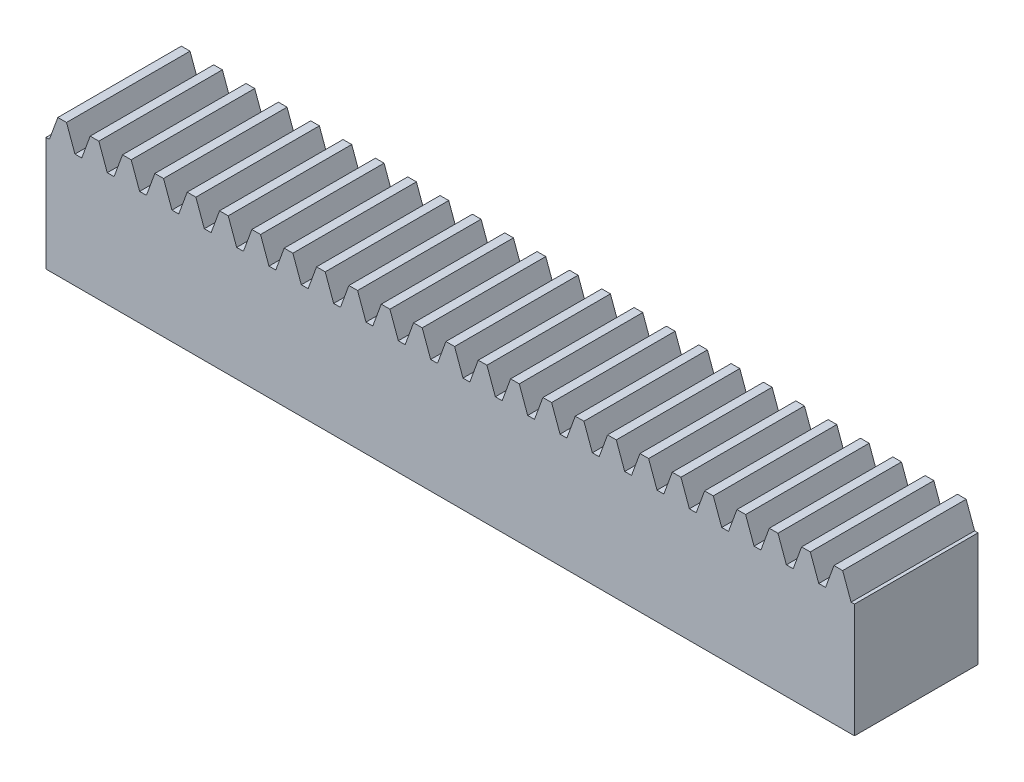
from build123d import *

# Parameters (mm, degrees)
BOSS_EXTRU_1_DEPTH = 9


with BuildPart() as part:
    # Esquisse1 → Boss.-Extru.1 (new body)
    with BuildSketch(Plane(origin=(0, 0, 0), x_dir=(-1, 0, 0), z_dir=(0, 0, -1))):
        Polygon((-58.904862255, 8.3125), (-58.904862255, 0), (0, 0), (0, 8.3125), (-0.247826528, 8.3125), (-0.862026298, 10), (-1.494168192, 10), (-2.108367962, 8.3125), (-2.604021018, 8.3125), (-3.218220788, 10), (-3.850362682, 10), (-4.464562452, 8.3125), (-4.960215508, 8.3125), (-5.574415279, 10), (-6.206557172, 10), (-6.820756943, 8.3125), (-7.316409999, 8.3125), (-7.930609769, 10), (-8.562751663, 10), (-9.176951433, 8.3125), (-9.672604489, 8.3125), (-10.286804259, 10), (-10.918946153, 10), (-11.533145923, 8.3125), (-12.028798979, 8.3125), (-12.642998749, 10), (-13.275140643, 10), (-13.889340413, 8.3125), (-14.384993469, 8.3125), (-14.999193239, 10), (-15.631335133, 10), (-16.245534903, 8.3125), (-16.741187959, 8.3125), (-17.35538773, 10), (-17.987529623, 10), (-18.601729394, 8.3125), (-19.097382449, 8.3125), (-19.71158222, 10), (-20.343724113, 10), (-20.957923884, 8.3125), (-21.45357694, 8.3125), (-22.06777671, 10), (-22.699918604, 10), (-23.314118374, 8.3125), (-23.80977143, 8.3125), (-24.4239712, 10), (-25.056113094, 10), (-25.670312864, 8.3125), (-26.16596592, 8.3125), (-26.78016569, 10), (-27.412307584, 10), (-28.026507354, 8.3125), (-28.52216041, 8.3125), (-29.136360181, 10), (-29.768502074, 10), (-30.382701845, 8.3125), (-30.8783549, 8.3125), (-31.492554671, 10), (-32.124696564, 10), (-32.738896335, 8.3125), (-33.234549391, 8.3125), (-33.848749161, 10), (-34.480891055, 10), (-35.095090825, 8.3125), (-35.590743881, 8.3125), (-36.204943651, 10), (-36.837085545, 10), (-37.451285315, 8.3125), (-37.946938371, 8.3125), (-38.561138141, 10), (-39.193280035, 10), (-39.807479805, 8.3125), (-40.303132861, 8.3125), (-40.917332632, 10), (-41.549474525, 10), (-42.163674296, 8.3125), (-42.659327351, 8.3125), (-43.273527122, 10), (-43.905669015, 10), (-44.519868786, 8.3125), (-45.015521842, 8.3125), (-45.629721612, 10), (-46.261863506, 10), (-46.876063276, 8.3125), (-47.371716332, 8.3125), (-47.985916102, 10), (-48.618057996, 10), (-49.232257766, 8.3125), (-49.727910822, 8.3125), (-50.342110592, 10), (-50.974252486, 10), (-51.588452256, 8.3125), (-52.084105312, 8.3125), (-52.698305082, 10), (-53.330446976, 10), (-53.944646747, 8.3125), (-54.440299802, 8.3125), (-55.054499573, 10), (-55.686641466, 10), (-56.300841237, 8.3125), (-56.796494293, 8.3125), (-57.410694063, 10), (-58.042835957, 10), (-58.657035727, 8.3125), align=None)
    extrude(amount=-BOSS_EXTRU_1_DEPTH)


solid = part.part
